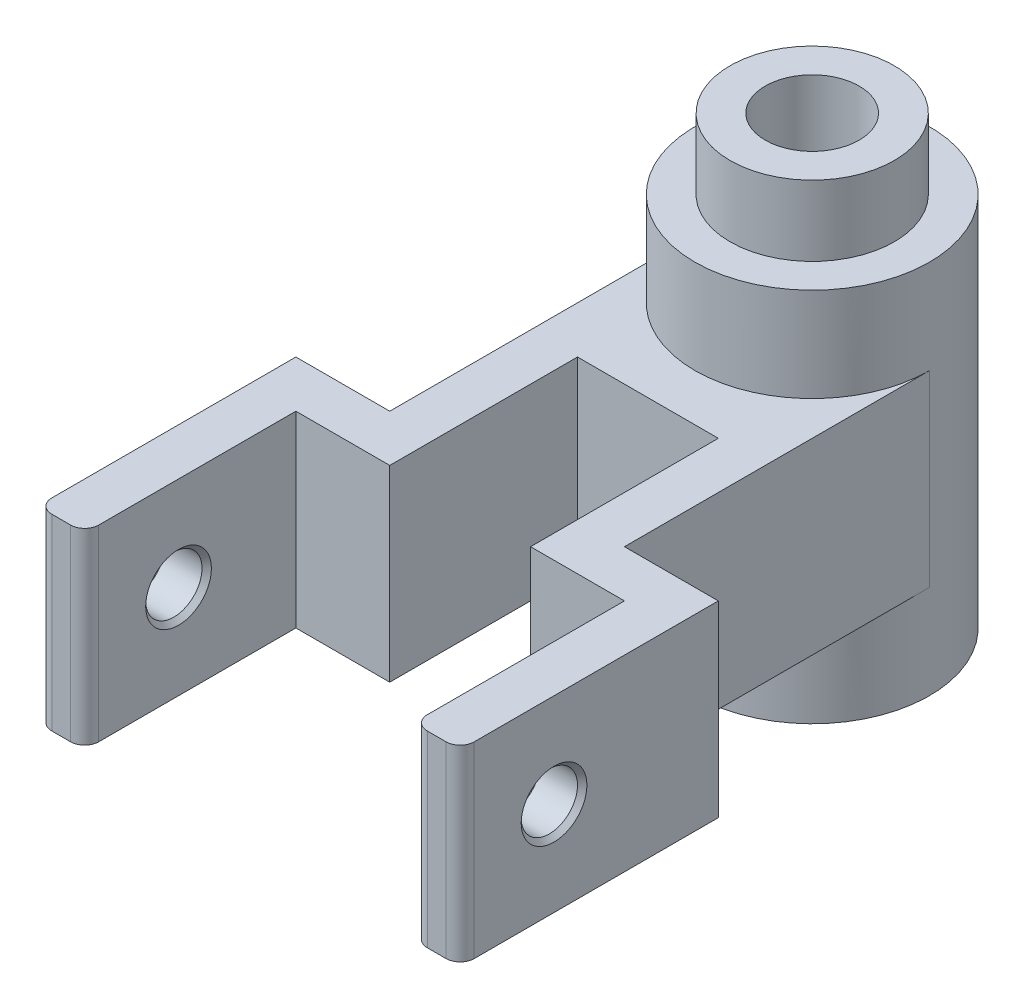
from build123d import *

# Parameters (mm, degrees)
BOSS_EXTRUDE2_DEPTH = 20
FILLET10_R          = 3
SKETCH2_R           = 6
CUT_EXTRUDE1_DEPTH  = 152.327459504
SKETCH3_R           = 25
BOSS_EXTRUDE6_DEPTH = 40
SKETCH5_R           = 17.5
BOSS_EXTRUDE7_DEPTH = 15
SKETCH6_R           = 10
CUT_EXTRUDE2_DEPTH  = 191.91883092
CHAMFER1_SIZE       = 1


with BuildPart() as part:
    # Sketch1 → Boss-Extrude2 (new, symmetric)
    with BuildSketch(Plane(origin=(0, 0, 0), x_dir=(1, 0, 0), z_dir=(0, 1, 0))):
        Polygon((0, 0), (0, 45), (20, 45), (20, 85), (50, 85), (50, 45), (70, 45), (70, 0), (80, 0), (80, 55), (60, 55), (60, 120), (10, 120), (10, 55), (-10, 55), (-10, 0), align=None)
    extrude(amount=BOSS_EXTRUDE2_DEPTH, both=True)

    # Fillet10
    fillet10_edges = [part.edges().sort_by_distance(p)[0] for p in [
        (-10, 0, 0),
        (80, 0, 0),
        (70, 0, 0),
        (0, 0, 0),
    ]]
    fillet(fillet10_edges, radius=FILLET10_R)

    # Sketch2 → Cut-Extrude1 (cut, through all)
    with BuildSketch(Plane(origin=(80, 0, 0), x_dir=(0, 0, -1), z_dir=(1, 0, 0))):
        with Locations((20, 0)):
            Circle(SKETCH2_R)
    extrude(amount=-CUT_EXTRUDE1_DEPTH, mode=Mode.SUBTRACT)

    # Sketch3 → Boss-Extrude6 (add, symmetric)
    with BuildSketch(Plane(origin=(0, 0, 0), x_dir=(1, 0, 0), z_dir=(0, 1, 0))):
        with Locations(Location((35, 120, 0), (0, 0, 270))):
            Circle(SKETCH3_R)
    extrude(amount=BOSS_EXTRUDE6_DEPTH, both=True)

    # Sketch5 → Boss-Extrude7 (add, symmetric)
    with BuildSketch(Plane(origin=(0, 40, 0), x_dir=(1, 0, 0), z_dir=(0, 1, 0))):
        with Locations(Location((35, 120, 0), (0, 0, 270))):
            Circle(SKETCH5_R)
    extrude(amount=BOSS_EXTRUDE7_DEPTH, both=True)

    # Sketch6 → Cut-Extrude2 (cut, through all)
    with BuildSketch(Plane(origin=(0, 55, 0), x_dir=(1, 0, 0), z_dir=(0, 1, 0))):
        with Locations(Location((35, 120, 0), (0, 0, 270))):
            Circle(SKETCH6_R)
    extrude(amount=-CUT_EXTRUDE2_DEPTH, mode=Mode.SUBTRACT)

    # Chamfer1
    chamfer1_edges = [part.edges().sort_by_distance(p)[0] for p in [
        (-10, 0, -14),
        (0, 0, -14),
        (70, 0, -14),
        (80, 0, -14),
    ]]
    chamfer(chamfer1_edges, length=CHAMFER1_SIZE)


solid = part.part
